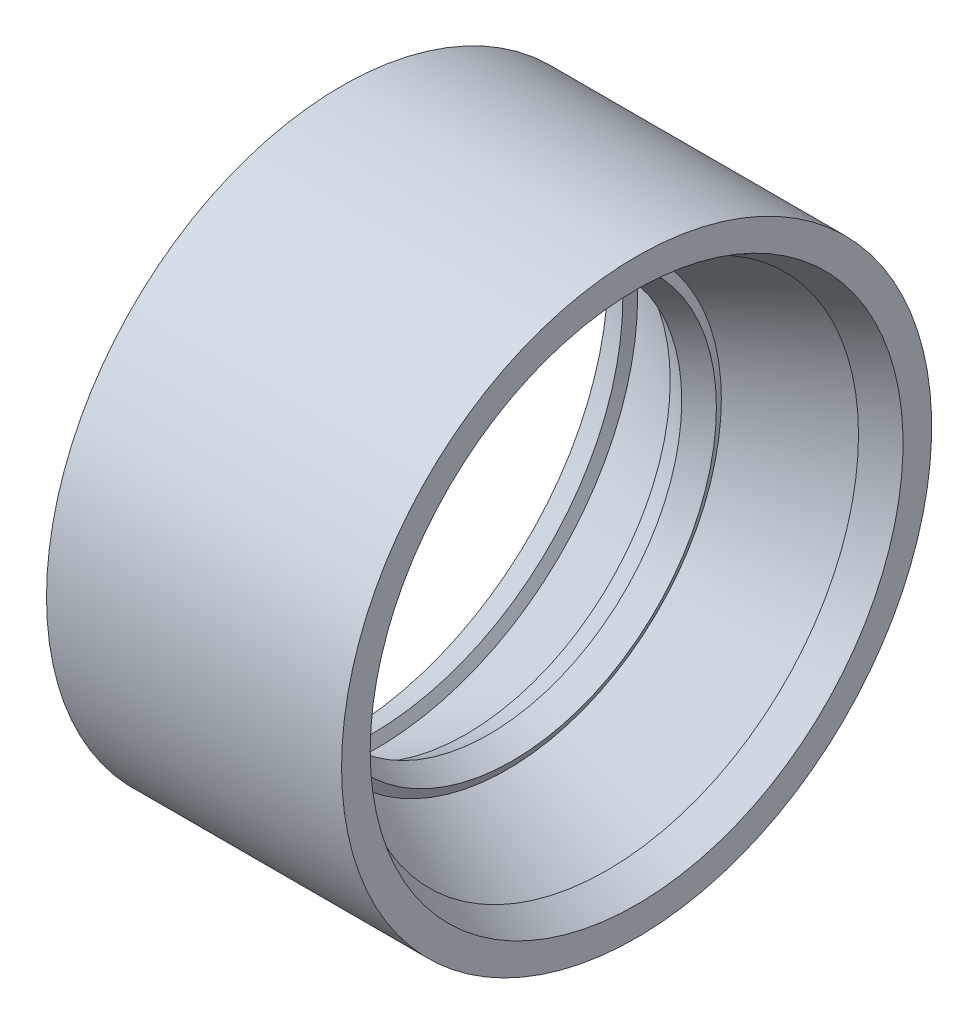
from build123d import *


with BuildPart() as part:
    # Sketch2 → Revolve1 (revolve)
    with BuildSketch(Plane.XY, mode=Mode.PRIVATE) as revolve1_sk:
        Polygon((0, 20), (40, 20), (40, 23.881966011), (35.975077641, 25.894427191), (35.304257247, 24.552786405), (22.459674775, 30.975077641), (23.130495168, 32.316718427), (20, 33.881966011), (16.869504832, 32.316718427), (17.540325225, 30.975077641), (4.695742753, 24.552786405), (4.024922359, 25.894427191), (0, 23.881966011), align=None)
    revolve(revolve1_sk.sketch.rotate(Axis((-13.667343935, 60, 0), (1, 0, 0)), 270), axis=Axis((-13.667343935, 60, 0), (1, 0, 0)))


solid = part.part
